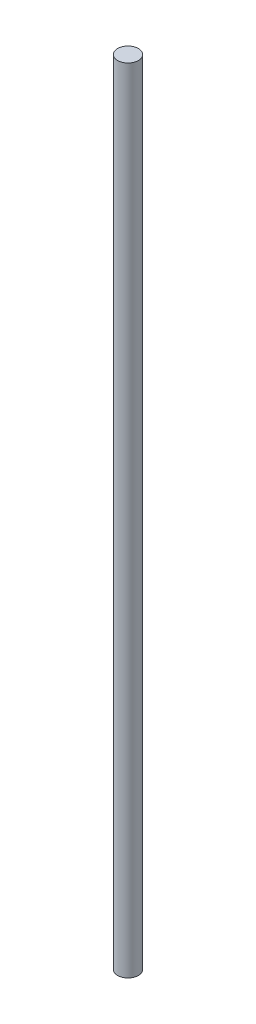
from build123d import *

# Parameters (mm, degrees)
SKETCH1_R           = 2.5
BOSS_EXTRUDE1_DEPTH = 190


with BuildPart() as part:
    # Sketch1 → Boss-Extrude1 (new body)
    with BuildSketch(Plane(origin=(0, 0, 0), x_dir=(1, 0, 0), z_dir=(0, 1, 0))):
        with Locations(Location((0, 0, 0), (0, 0, 270))):
            Circle(SKETCH1_R)
    extrude(amount=BOSS_EXTRUDE1_DEPTH)


solid = part.part
